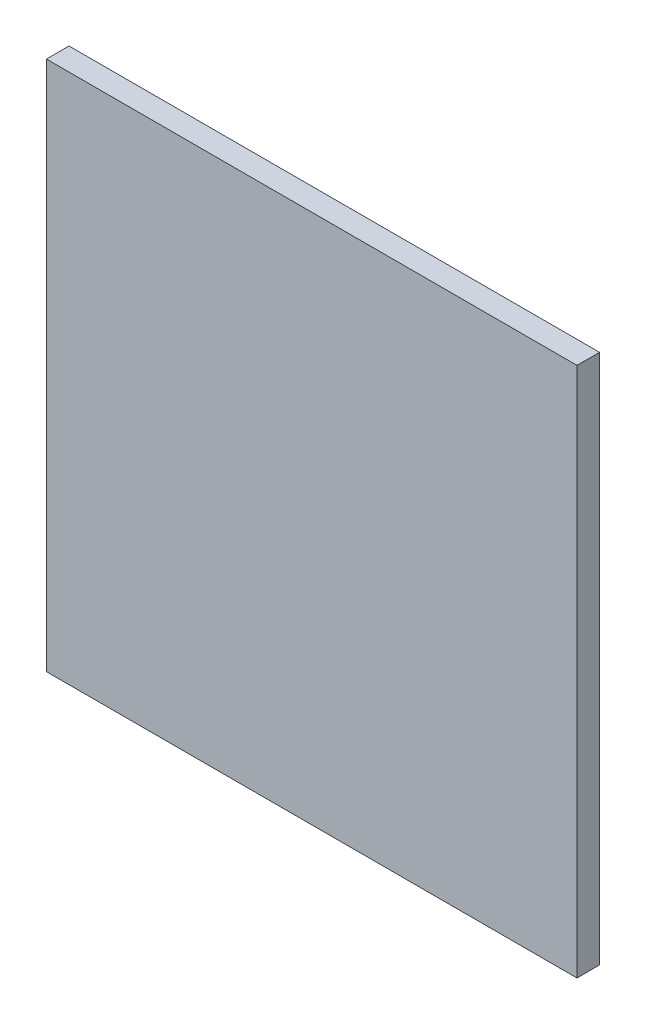
from build123d import *

# Parameters (mm, degrees)
IZIM1_W                     = 235
IZIM1_H                     = 235
Y_KSEKLIK_EKSTR_ZYON1_DEPTH = 10


with BuildPart() as part:
    # Çizim1 → Yükseklik-Ekstrüzyon1 (new body)
    with BuildSketch(Plane.XY):
        Rectangle(IZIM1_W, IZIM1_H)
    extrude(amount=Y_KSEKLIK_EKSTR_ZYON1_DEPTH)


solid = part.part
